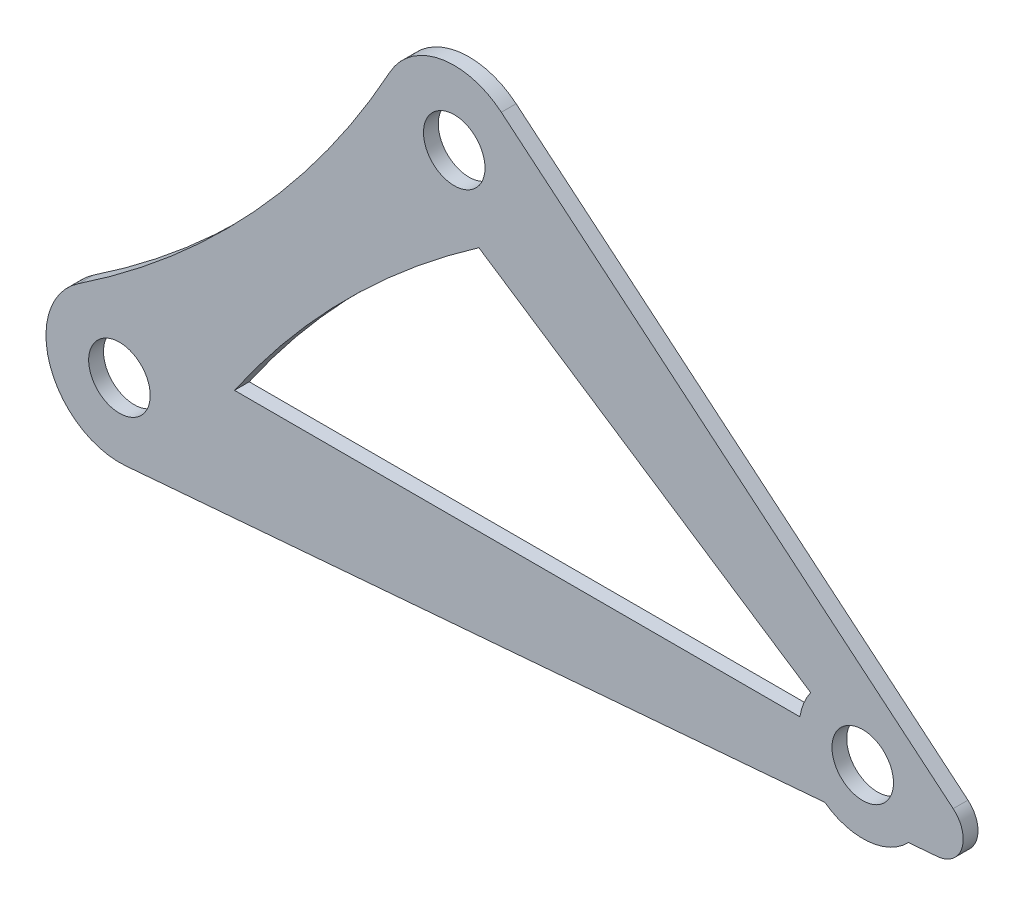
from build123d import *

# Parameters (mm, degrees)
ESQUISSE1_R        = 3.302
BOSS_EXTRU_2_DEPTH = 1.587
CONG_1_R           = 3


with BuildPart() as part:
    # Esquisse1 → Boss.-Extru.2 (new body)
    with BuildSketch(Plane(origin=(0, 0, 0), x_dir=(0, 1, 0), z_dir=(0, 0, 1))):
        with BuildLine():
            Line((-0.865912697, 10.406603399), (0, 0))
            Line((0, 0), (45.164905045, 54.107342637))
            ThreePointArc((45.164905045, 54.107342637), (46.860747383, 60.617730495), (42.915369181, 66.067044408))
            ThreePointArc((42.915369181, 66.067044408), (22.727341061, 80.577470806), (6.560094465, 99.464744063))
            ThreePointArc((6.560094465, 99.464744063), (-2.596669453, 102.535168417), (-7.857844745, 94.436164423))
            Line((-7.857844745, 94.436164423), (-1.612927072, 19.384277892))
            ThreePointArc((-1.612927072, 19.384277892), (-2.927440017, 14.754983859), (-0.865912697, 10.406603399))
        make_face()
        with Locations(Location((3.885, 15.321833395, 0), (0, 0, 270))):
            Circle(ESQUISSE1_R, mode=Mode.SUBTRACT)
        with BuildLine():
            Line((5, 22.066270538), (5, 82.747179925))
            ThreePointArc((5, 82.747179925), (19.367518455, 70.82097994), (31.370848456, 56.517836875))
            Line((31.370848456, 56.517836875), (7.827581381, 20.90633959))
            ThreePointArc((7.827581381, 20.90633959), (6.479444508, 21.646350379), (5, 22.066270538))
        make_face(mode=Mode.SUBTRACT)
        with Locations(Location((0, 95.09, 0), (0, 0, 270))):
            Circle(ESQUISSE1_R, mode=Mode.SUBTRACT)
        with Locations(Location((39.111633766, 59.160176675, 0), (0, 0, 270))):
            Circle(ESQUISSE1_R, mode=Mode.SUBTRACT)
    extrude(amount=BOSS_EXTRU_2_DEPTH)

    # Congé1
    cong_1_edges = [part.edges().sort_by_distance(p)[0] for p in [
        (0, 0, 0.7935),
    ]]
    fillet(cong_1_edges, radius=CONG_1_R)


solid = part.part
